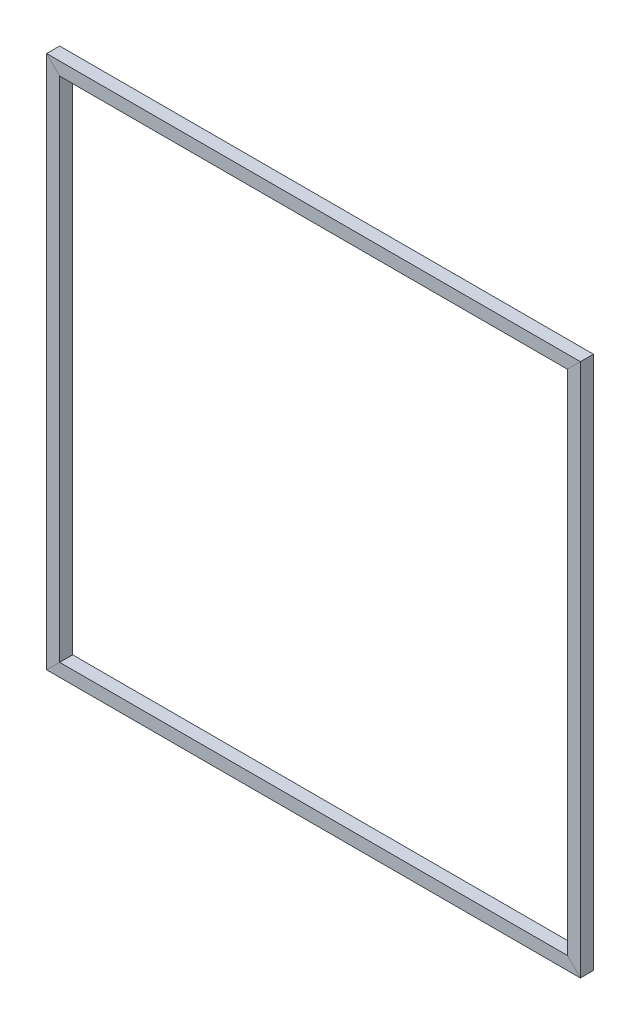
from build123d import *

# Parameters (mm, degrees)
STRUCTURAL_MEMBER1_DEPTH      = 10177.776695297
STRUCTURAL_MEMBER1_DEPTH_BACK = 177.776695297
SKETCH11_W                    = 250
SKETCH11_H                    = 250
SKETCH11_ON_SEGMENT_2_W       = 250
SKETCH11_ON_SEGMENT_2_H       = 250
STRUCTURAL_MEMBER1_2_DEPTH    = 10355.553390593
SKETCH11_ON_SEGMENT_3_W       = 250
SKETCH11_ON_SEGMENT_3_H       = 250
STRUCTURAL_MEMBER1_3_DEPTH    = 10355.553390593
SKETCH11_ON_SEGMENT_4_W       = 250
SKETCH11_ON_SEGMENT_4_H       = 250
STRUCTURAL_MEMBER1_4_DEPTH    = 10355.553390593


with BuildPart() as part:
    # Sketch11 → Structural Member1 (new, two sides: drawn at the far end of the back side and taken through both)
    with BuildSketch(Plane(origin=(-5000, -5000, 0), x_dir=(-1, 0, 0), z_dir=(0, 1, 0)).offset(-STRUCTURAL_MEMBER1_DEPTH_BACK)):
        Rectangle(SKETCH11_W, SKETCH11_H)
    extrude(amount=STRUCTURAL_MEMBER1_DEPTH + STRUCTURAL_MEMBER1_DEPTH_BACK)

    # Structural Member1 mitre 1
    split(bisect_by=Plane(origin=(-5000, -5000, 0), x_dir=(-0.707106781, -0.707106781, 0), z_dir=(-0.707106781, 0.707106781, 0)), keep=Keep.TOP)

    # Structural Member1 mitre 2
    split(bisect_by=Plane(origin=(-5000, 5000, 0), x_dir=(0.707106781, -0.707106781, 0), z_dir=(-0.707106781, -0.707106781, 0)), keep=Keep.TOP)


with BuildPart() as body_2:
    # Sketch11 on segment 2 (carried to segment 2) → Structural Member1 2 (new body)
    with BuildSketch(Plane(origin=(-5177.776695297, 5000, 0), x_dir=(0, 1, 0), z_dir=(1, 0, 0))):
        Rectangle(SKETCH11_ON_SEGMENT_2_W, SKETCH11_ON_SEGMENT_2_H)
    extrude(amount=STRUCTURAL_MEMBER1_2_DEPTH)

    # Structural Member1 2 mitre 1
    split(bisect_by=Plane(origin=(5000, 5000, 0), x_dir=(-0.707106781, -0.707106781, 0), z_dir=(-0.707106781, 0.707106781, 0)), keep=Keep.TOP)

    # Structural Member1 2 mitre 2
    split(bisect_by=Plane(origin=(-5000, 5000, 0), x_dir=(-0.707106781, 0.707106781, 0), z_dir=(0.707106781, 0.707106781, 0)), keep=Keep.TOP)


with BuildPart() as body_3:
    # Sketch11 on segment 3 (carried to segment 3) → Structural Member1 3 (new body)
    with BuildSketch(Plane(origin=(5000, 5177.776695297, 0), x_dir=(1, 0, 0), z_dir=(0, -1, 0))):
        Rectangle(SKETCH11_ON_SEGMENT_3_W, SKETCH11_ON_SEGMENT_3_H)
    extrude(amount=STRUCTURAL_MEMBER1_3_DEPTH)

    # Structural Member1 3 mitre 1
    split(bisect_by=Plane(origin=(5000, -5000, 0), x_dir=(-0.707106781, 0.707106781, 0), z_dir=(0.707106781, 0.707106781, 0)), keep=Keep.TOP)

    # Structural Member1 3 mitre 2
    split(bisect_by=Plane(origin=(5000, 5000, 0), x_dir=(0.707106781, 0.707106781, 0), z_dir=(0.707106781, -0.707106781, 0)), keep=Keep.TOP)


with BuildPart() as body_4:
    # Sketch11 on segment 4 (carried to segment 4) → Structural Member1 4 (new body)
    with BuildSketch(Plane(origin=(5177.776695297, -5000, 0), x_dir=(0, -1, 0), z_dir=(-1, 0, 0))):
        Rectangle(SKETCH11_ON_SEGMENT_4_W, SKETCH11_ON_SEGMENT_4_H)
    extrude(amount=STRUCTURAL_MEMBER1_4_DEPTH)

    # Structural Member1 4 mitre 1
    split(bisect_by=Plane(origin=(5000, -5000, 0), x_dir=(0.707106781, -0.707106781, 0), z_dir=(-0.707106781, -0.707106781, 0)), keep=Keep.TOP)

    # Structural Member1 4 mitre 2
    split(bisect_by=Plane(origin=(-5000, -5000, 0), x_dir=(0.707106781, 0.707106781, 0), z_dir=(0.707106781, -0.707106781, 0)), keep=Keep.TOP)


solid = Compound([part.part, body_2.part, body_3.part, body_4.part])
